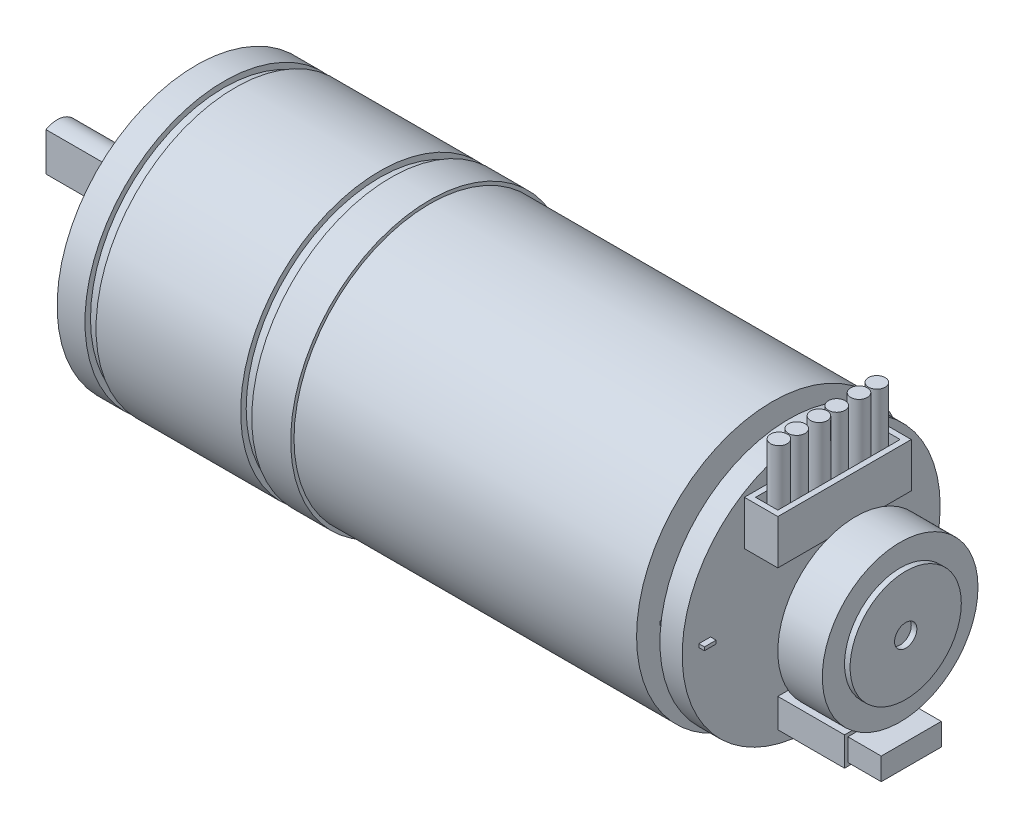
from build123d import *

# Parameters (mm, degrees)
CROQUIS3_R               = 12.5
SALIENTE_EXTRUIR1_DEPTH  = 21
CROQUIS6_R               = 12.5
CROQUIS6_R_2             = 12
CORTAR_EXTRUIR3_DEPTH    = 1
CROQUIS7_R               = 12.5
CROQUIS7_R_2             = 12
CORTAR_EXTRUIR4_DEPTH    = 1
CROQUIS8_R               = 3.5
SALIENTE_EXTRUIR3_DEPTH  = 2.5
CROQUIS9_R               = 2
SALIENTE_EXTRUIR4_DEPTH  = 12.5
CROQUIS10_W              = 8
CROQUIS10_H              = 4
CORTAR_EXTRUIR5_DEPTH    = 5
CROQUIS11_R              = 1.5
CORTAR_EXTRUIR6_DEPTH    = 3
CROQUIS12_R              = 2
CORTAR_EXTRUIR7_DEPTH    = 3
CORTAR_EXTRUIR8_DEPTH    = 1.5
CORTAR_EXTRUIR9_DEPTH    = 1.5
REDONDEO1_R              = 0.25
CROQUIS16_W              = 1.05
CROQUIS16_H              = 0.3
SALIENTE_EXTRUIR5_DEPTH  = 4
CROQUIS17_R              = 4
SALIENTE_EXTRUIR6_DEPTH  = 0.75
SALIENTE_EXTRUIR7_START  = 0.75
CROQUIS18_R              = 3.5
SALIENTE_EXTRUIR7_DEPTH  = 0.75
CROQUIS19_R              = 11.6
SALIENTE_EXTRUIR8_DEPTH  = 2
CROQUIS20_R              = 1
SALIENTE_EXTRUIR9_DEPTH  = 4
CROQUIS21_R              = 7
SALIENTE_EXTRUIR10_DEPTH = 4
CROQUIS22_R              = 5
SALIENTE_EXTRUIR11_DEPTH = 0.5
CORTAR_EXTRUIR10_START   = -0.5
CROQUIS23_R              = 1
CORTAR_EXTRUIR10_DEPTH   = 0.5
SALIENTE_EXTRUIR12_DEPTH = 3
CORTAR_EXTRUIR11_DEPTH   = 3.5
CROQUIS26_R              = 0.75
SALIENTE_EXTRUIR13_DEPTH = 8
SALIENTE_EXTRUIR14_DEPTH = 6
CROQUIS28_W              = 5.4
CROQUIS28_H              = 2
SALIENTE_EXTRUIR15_DEPTH = 3


with BuildPart() as part:
    # Croquis1 → Revolución-Lámina1 (revolve)
    with BuildSketch(Plane.XY, mode=Mode.PRIVATE) as revoluci_n_l_mina1_sk:
        Polygon((0, 0), (0, 12.2), (30.8, 12.2), (30.8, 0), (20.8, 0), (20.8, 2.2), (10, 2.2), (10, 0), align=None)
    revolve(revoluci_n_l_mina1_sk.sketch.rotate(Axis((0, 0, 0), (1, 0, 0)), 90), axis=Axis((0, 0, 0), (1, 0, 0)))

    # Croquis3 → Saliente-Extruir1 (add)
    with BuildSketch(Plane.ZY):
        with Locations(Location((0, 0, 0), (0, 0, 180))):
            Circle(CROQUIS3_R)
    extrude(amount=SALIENTE_EXTRUIR1_DEPTH)

    # Croquis6 → Cortar-Extruir3 (cut)
    with BuildSketch(Plane(origin=(-17.5, 0, 0), x_dir=(0, 0, -1), z_dir=(1, 0, 0))):
        Circle(CROQUIS6_R)
        Circle(CROQUIS6_R_2, mode=Mode.SUBTRACT)
    extrude(amount=-CORTAR_EXTRUIR3_DEPTH, mode=Mode.SUBTRACT)

    # Croquis7 → Cortar-Extruir4 (cut)
    with BuildSketch(Plane(origin=(-3.5, 0, 0), x_dir=(0, 0, -1), z_dir=(1, 0, 0))):
        Circle(CROQUIS7_R)
        Circle(CROQUIS7_R_2, mode=Mode.SUBTRACT)
    extrude(amount=-CORTAR_EXTRUIR4_DEPTH, mode=Mode.SUBTRACT)

    # Croquis8 → Saliente-Extruir3 (add)
    with BuildSketch(Plane.ZY.offset(21)):
        Circle(CROQUIS8_R)
    extrude(amount=SALIENTE_EXTRUIR3_DEPTH)

    # Croquis9 → Saliente-Extruir4 (add)
    with BuildSketch(Plane.ZY.offset(21)):
        Circle(CROQUIS9_R)
    extrude(amount=SALIENTE_EXTRUIR4_DEPTH)

    # Croquis10 → Cortar-Extruir5 (cut)
    with BuildSketch(Plane.XY.offset(1)):
        with Locations((-29.5, 0)):
            Rectangle(CROQUIS10_W, CROQUIS10_H)
    extrude(amount=CORTAR_EXTRUIR5_DEPTH, mode=Mode.SUBTRACT)

    # Croquis11 → Cortar-Extruir6 (cut)
    with BuildSketch(Plane.ZY.offset(21)):
        with Locations((-8, 0)):
            Circle(CROQUIS11_R)
        with Locations((8, 0)):
            Circle(CROQUIS11_R)
    extrude(amount=-CORTAR_EXTRUIR6_DEPTH, mode=Mode.SUBTRACT)

    # Croquis12 → Cortar-Extruir7 (cut)
    with BuildSketch(Plane.ZY.offset(21)):
        with Locations((0, -8.5)):
            Circle(CROQUIS12_R)
        with Locations((0, 8.5)):
            Circle(CROQUIS12_R)
    extrude(amount=-CORTAR_EXTRUIR7_DEPTH, mode=Mode.SUBTRACT)

    # Croquis14 → Cortar-Extruir8 (cut)
    with BuildSketch(Plane.ZY.offset(18)):
        Polygon((-0.25, 8.25), (-0.25, 7.2), (0.25, 7.2), (0.25, 8.25), (1.3, 8.25), (1.3, 8.75), (0.25, 8.75), (0.25, 9.8), (-0.25, 9.8), (-0.25, 8.75), (-1.3, 8.75), (-1.3, 8.25), align=None)
    extrude(amount=-CORTAR_EXTRUIR8_DEPTH, mode=Mode.SUBTRACT)

    # Croquis15 → Cortar-Extruir9 (cut)
    with BuildSketch(Plane.ZY.offset(18)):
        Polygon((-0.25, -8.75), (-0.25, -9.8), (0.25, -9.8), (0.25, -8.75), (1.3, -8.75), (1.3, -8.25), (0.25, -8.25), (0.25, -7.2), (-0.25, -7.2), (-0.25, -8.25), (-1.3, -8.25), (-1.3, -8.75), align=None)
    extrude(amount=-CORTAR_EXTRUIR9_DEPTH, mode=Mode.SUBTRACT)

    # Redondeo1
    redondeo1_edges = [part.edges().sort_by_distance(p)[0] for p in [
        (-18, -8.5, -2),
        (-18, 8.5, -2),
    ]]
    fillet(redondeo1_edges, radius=REDONDEO1_R)

    # Croquis16 → Saliente-Extruir5 (add)
    with BuildSketch(Plane(origin=(30.8, 0, 0), x_dir=(0, 0, -1), z_dir=(1, 0, 0))):
        with Locations((-9.575, 0)):
            Rectangle(CROQUIS16_W, CROQUIS16_H)
        with Locations((8.525, 0)):
            Rectangle(CROQUIS16_W, CROQUIS16_H)
    extrude(amount=SALIENTE_EXTRUIR5_DEPTH)

    # Croquis17 → Saliente-Extruir6 (add)
    with BuildSketch(Plane(origin=(30.8, 0, 0), x_dir=(0, 0, -1), z_dir=(1, 0, 0))):
        Circle(CROQUIS17_R)
    extrude(amount=SALIENTE_EXTRUIR6_DEPTH)

    # Croquis18 → Saliente-Extruir7 (add)
    with BuildSketch(Plane(origin=(31.55, 0, 0), x_dir=(0, 0, -1), z_dir=(1, 0, 0)).offset(SALIENTE_EXTRUIR7_START)):
        with Locations(Location((0, 0, 0), (0, 0, 180))):
            Circle(CROQUIS18_R)
    extrude(amount=-SALIENTE_EXTRUIR7_DEPTH)

    # Croquis19 → Saliente-Extruir8 (add)
    with BuildSketch(Plane(origin=(32.3, 0, 0), x_dir=(0, 0, -1), z_dir=(1, 0, 0))):
        Circle(CROQUIS19_R)
    extrude(amount=SALIENTE_EXTRUIR8_DEPTH)

    # Croquis20 → Saliente-Extruir9 (add)
    with BuildSketch(Plane(origin=(34.3, 0, 0), x_dir=(0, 0, -1), z_dir=(1, 0, 0))):
        Circle(CROQUIS20_R)
    extrude(amount=SALIENTE_EXTRUIR9_DEPTH)

    # Croquis21 → Saliente-Extruir10 (add)
    with BuildSketch(Plane(origin=(38.3, 0, 0), x_dir=(0, 0, -1), z_dir=(1, 0, 0))):
        Circle(CROQUIS21_R)
    extrude(amount=SALIENTE_EXTRUIR10_DEPTH)

    # Croquis22 → Saliente-Extruir11 (add)
    with BuildSketch(Plane(origin=(42.3, 0, 0), x_dir=(0, 0, -1), z_dir=(1, 0, 0))):
        Circle(CROQUIS22_R)
    extrude(amount=SALIENTE_EXTRUIR11_DEPTH)

    # Croquis23 → Cortar-Extruir10 (cut)
    with BuildSketch(Plane(origin=(42.8, 0, 0), x_dir=(0, 0, -1), z_dir=(1, 0, 0)).offset(CORTAR_EXTRUIR10_START)):
        Circle(CROQUIS23_R)
    extrude(amount=CORTAR_EXTRUIR10_DEPTH, mode=Mode.SUBTRACT)

    # Croquis24 → Saliente-Extruir12 (add)
    with BuildSketch(Plane(origin=(34.3, 0, 0), x_dir=(0, 0, -1), z_dir=(1, 0, 0))):
        Polygon((0, 9.5), (6, 9.5), (6, 5.5), (-6, 5.5), (-6, 9.5), align=None)
    extrude(amount=SALIENTE_EXTRUIR12_DEPTH)

    # Croquis25 → Cortar-Extruir11 (cut)
    with BuildSketch(Plane(origin=(0, 9.5, 0), x_dir=(1, 0, 0), z_dir=(0, 1, 0))):
        Polygon((36.8, -5.5), (36.8, 5.5), (34.8, 5.5), (34.8, -5.5), (35.8, -5.5), align=None)
    extrude(amount=-CORTAR_EXTRUIR11_DEPTH, mode=Mode.SUBTRACT)

    # Croquis26 → Saliente-Extruir13 (add)
    with BuildSketch(Plane(origin=(0, 6, 0), x_dir=(1, 0, 0), z_dir=(0, 1, 0))):
        with Locations(Location((35.8, -4.4, 0), (0, 0, 270))):
            Circle(CROQUIS26_R)
        with Locations(Location((35.8, -2.8, 0), (0, 0, 270))):
            Circle(CROQUIS26_R)
        with Locations(Location((35.8, -0.8, 0), (0, 0, 270))):
            Circle(CROQUIS26_R)
        with Locations(Location((35.8, 0.8, 0), (0, 0, 270))):
            Circle(CROQUIS26_R)
        with Locations(Location((35.8, 2.8, 0), (0, 0, 270))):
            Circle(CROQUIS26_R)
        with Locations(Location((35.8, 4.4, 0), (0, 0, 270))):
            Circle(CROQUIS26_R)
    extrude(amount=SALIENTE_EXTRUIR13_DEPTH)

    # Croquis27 → Saliente-Extruir14 (add)
    with BuildSketch(Plane(origin=(34.3, 0, 0), x_dir=(0, 0, -1), z_dir=(1, 0, 0))):
        Polygon((0, -10.1), (3, -10.1), (3, -7.5), (-3, -7.5), (-3, -10.1), align=None)
    extrude(amount=SALIENTE_EXTRUIR14_DEPTH)

    # Croquis28 → Saliente-Extruir15 (add)
    with BuildSketch(Plane(origin=(40.3, 0, 0), x_dir=(0, 0, -1), z_dir=(1, 0, 0))):
        with Locations((0, -8.8)):
            Rectangle(CROQUIS28_W, CROQUIS28_H)
    extrude(amount=SALIENTE_EXTRUIR15_DEPTH)


solid = part.part
